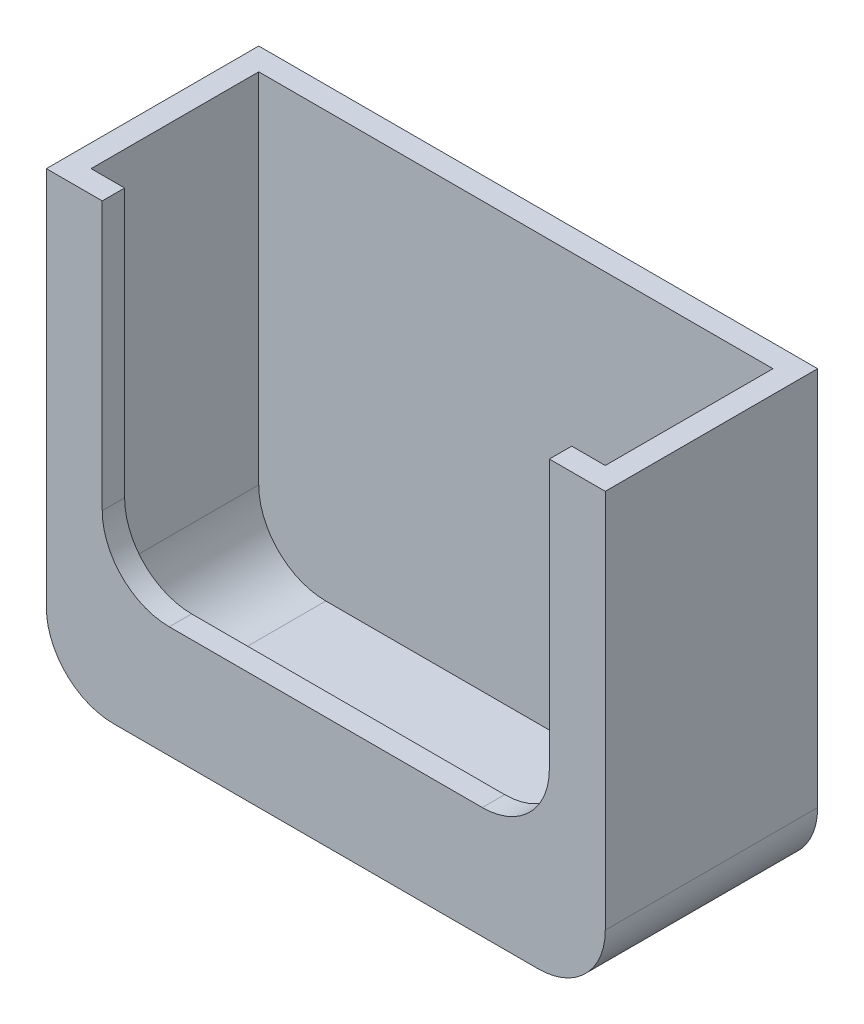
from build123d import *

# Parameters (mm, degrees)
SKETCH_1_W          = 50
SKETCH_1_H          = 40
EXTRUDE_1_DEPTH     = 19
SKETCH_2_W          = 46
SKETCH_2_H          = 15
CUT_EXTRUDE_1_DEPTH = 38
SKETCH_3_W          = 40
SKETCH_3_H          = 2
CUT_EXTRUDE_2_DEPTH = 30
FILLET_1_R          = 6


with BuildPart() as part:
    # 스케치1 → 보스-돌출1 (new body)
    with BuildSketch(Plane.XY):
        Rectangle(SKETCH_1_W, SKETCH_1_H)
    extrude(amount=EXTRUDE_1_DEPTH)

    # 스케치2 → 컷-돌출1 (cut)
    with BuildSketch(Plane(origin=(0, 20, 0), x_dir=(1, 0, 0), z_dir=(0, 1, 0))):
        with Locations((0, -9.5)):
            Rectangle(SKETCH_2_W, SKETCH_2_H)
    extrude(amount=-CUT_EXTRUDE_1_DEPTH, mode=Mode.SUBTRACT)

    # 스케치3 → 컷-돌출2 (cut)
    with BuildSketch(Plane(origin=(0, 20, 0), x_dir=(1, 0, 0), z_dir=(0, 1, 0))):
        with Locations((0, -18)):
            Rectangle(SKETCH_3_W, SKETCH_3_H)
    extrude(amount=-CUT_EXTRUDE_2_DEPTH, mode=Mode.SUBTRACT)

    # 필렛1
    fillet_1_edges = [part.edges().sort_by_distance(p)[0] for p in [
        (23, -18, 9.5),
        (-23, -18, 9.5),
        (20, -10, 18),
        (-20, -10, 18),
        (25, -20, 9.5),
        (-25, -20, 9.5),
    ]]
    fillet(fillet_1_edges, radius=FILLET_1_R)


solid = part.part
